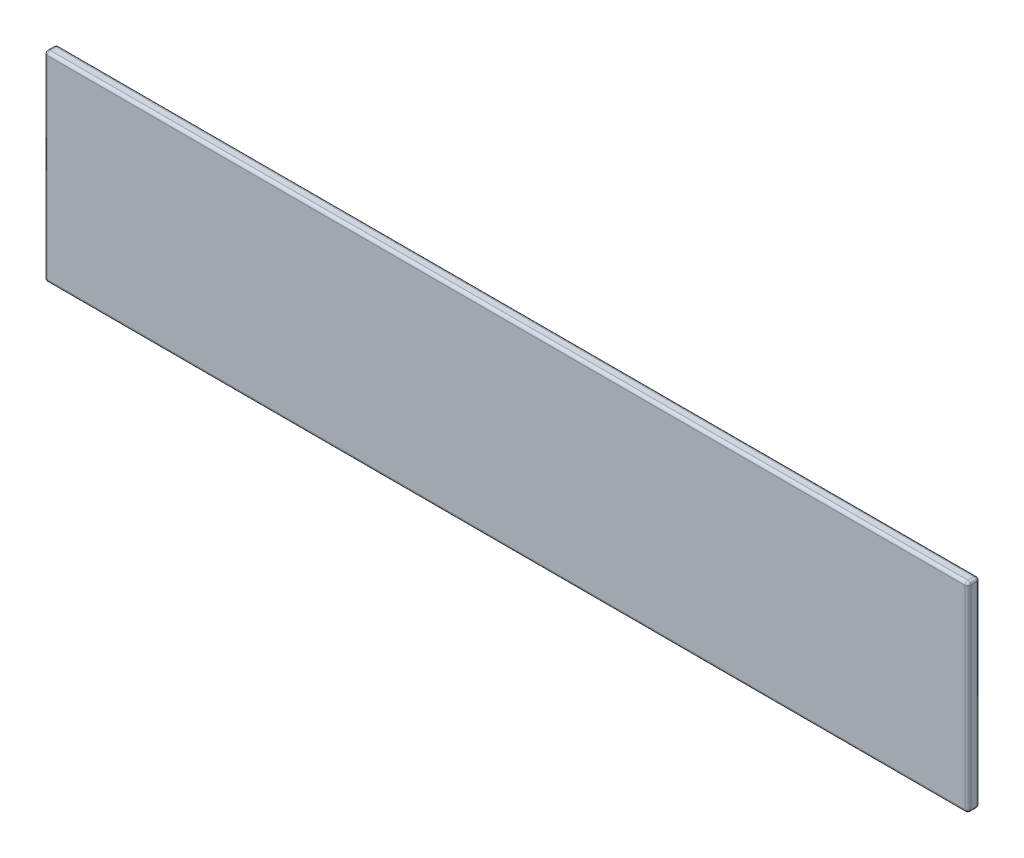
from build123d import *

# Parameters (mm, degrees)
SKETCH1_W           = 154.7
SKETCH1_H           = 33.5
BOSS_EXTRUDE1_DEPTH = 2
FILLET1_R           = 0.5


with BuildPart() as part:
    # Sketch1 → Boss-Extrude1 (new body)
    with BuildSketch(Plane.XY):
        Rectangle(SKETCH1_W, SKETCH1_H)
    extrude(amount=BOSS_EXTRUDE1_DEPTH)

    # Fillet1
    fillet1_edges = [part.edges().sort_by_distance(p)[0] for p in [
        (-77.35, 0, 2),
        (0, -16.75, 2),
        (77.35, 0, 2),
        (0, -16.75, 0),
        (-77.35, 0, 0),
        (0, 16.75, 0),
        (77.35, 0, 0),
        (77.35, -16.75, 1),
        (-77.35, -16.75, 1),
        (-77.35, 16.75, 1),
        (77.35, 16.75, 1),
        (0, 16.75, 2),
    ]]
    fillet(fillet1_edges, radius=FILLET1_R)


solid = part.part
